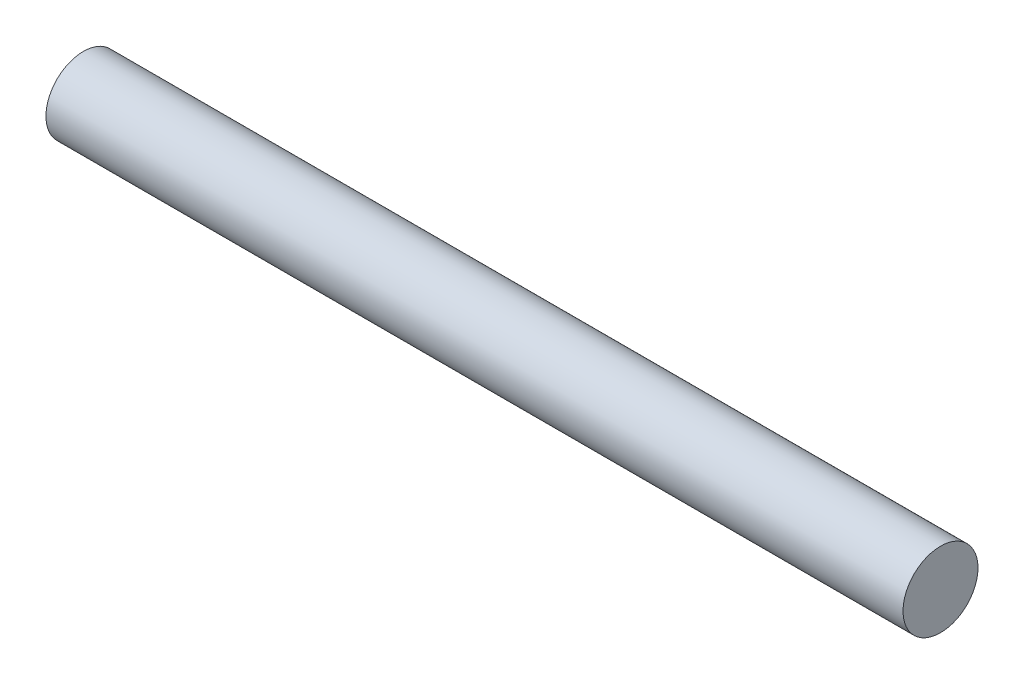
from build123d import *

# Parameters (mm, degrees)
SKETCH1_R  = 2.5
BASE_DEPTH = 57.15


with BuildPart() as part:
    # Sketch1 → Base (new body)
    with BuildSketch(Plane(origin=(0, 0, 0), x_dir=(0, 0, -1), z_dir=(1, 0, 0))):
        Circle(SKETCH1_R)
    extrude(amount=BASE_DEPTH)


solid = part.part
